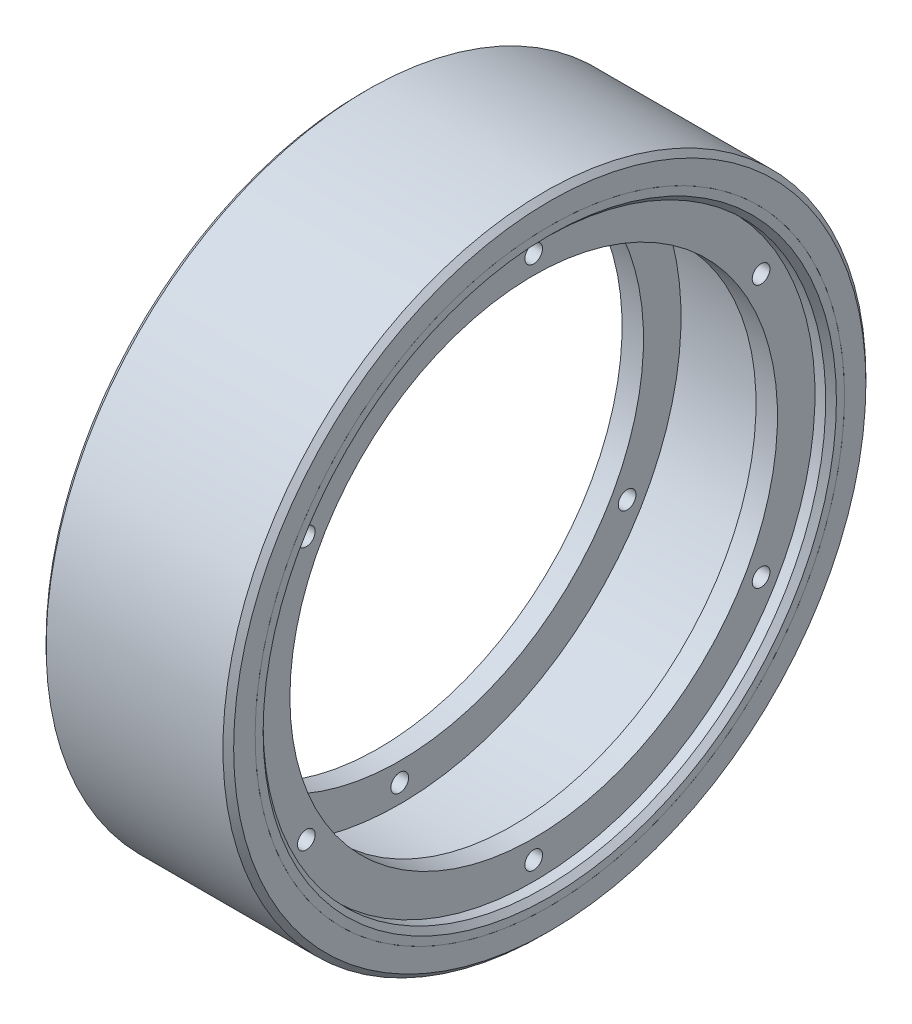
from build123d import *

# Parameters (mm, degrees)
SKETCH_1_R                  = 60
SKETCH_1_R_2                = 55
EXTRUDE_1_DEPTH             = 17.5
SKETCH_5_W                  = 1.65
SKETCH_5_H                  = 32
HOLE_WIZARD_M4_1_AT_2_COUNT = 2
HOLE_WIZARD_M4_1_AT_2_PITCH = 49
HOLE_WIZARD_M4_1_AT_3_COUNT = 2
HOLE_WIZARD_M4_1_AT_3_PITCH = 84.870489571
HOLE_WIZARD_M4_1_AT_4_COUNT = 2
HOLE_WIZARD_M4_1_AT_4_PITCH = 98
HOLE_WIZARD_M4_1_AT_5_COUNT = 2
HOLE_WIZARD_M4_1_AT_5_PITCH = 84.870489571
HOLE_WIZARD_M4_1_AT_6_COUNT = 2
HOLE_WIZARD_M4_1_AT_6_PITCH = 49
CHAMFER_1_SIZE              = 1
CHAMFER_2_SIZE              = 1


with BuildPart() as part:
    # 草图1 → 凸台-拉伸1 (new, symmetric)
    with BuildSketch(Plane(origin=(0, 0, 0), x_dir=(0, 0, -1), z_dir=(1, 0, 0))):
        Circle(SKETCH_1_R)
        Circle(SKETCH_1_R_2, mode=Mode.SUBTRACT)
    extrude(amount=EXTRUDE_1_DEPTH, both=True)

    # 倒角1
    chamfer_1_edges = [part.edges().sort_by_distance(p)[0] for p in [
        (-17.5, 0, 60),
        (17.5, 0, 60),
    ]]
    chamfer(chamfer_1_edges, length=CHAMFER_1_SIZE)


with BuildPart() as body_2:
    # 草图2 → 旋转1 (revolve)
    with BuildSketch(Plane.XY, mode=Mode.PRIVATE) as revolve_1_sk:
        Polygon((17.5, 55), (-17.5, 55), (-17.5, 52.5), (-14.5, 52.5), (-14.5, 45.5), (-10.5, 45.5), (-10.5, 52.5), (10.5, 52.5), (10.5, 45.5), (14.5, 45.5), (14.5, 52.5), (17.5, 52.5), align=None)
    revolve(revolve_1_sk.sketch.rotate(Axis((0, 0, 0), (1, 0, 0)), 90), axis=Axis((0, 0, 0), (1, 0, 0)))

    # 草图5 → M4 螺纹孔1 (revolve, cut)
    with BuildSketch(Plane(origin=(-14.5, 49, 0), x_dir=(0, 0, 1), z_dir=(0, 1, 0))):
        with Locations((0.825, 16)):
            Rectangle(SKETCH_5_W, SKETCH_5_H)
    hole_wizard_m4_1 = revolve(axis=Axis((-20.85, 49, 0), (1, 0, 0)), mode=Mode.SUBTRACT)

    # M4 螺纹孔1 at 2: M4 螺纹孔1 ×2
    with Locations(*[Vector(0, -0.49999999999999994, 0.8660254037844387) * (i * HOLE_WIZARD_M4_1_AT_2_PITCH) for i in range(1, HOLE_WIZARD_M4_1_AT_2_COUNT)]):
        add(hole_wizard_m4_1, mode=Mode.SUBTRACT)

    # M4 螺纹孔1 at 3: M4 螺纹孔1 ×2
    with Locations(*[Vector(0, -0.8660254037844386, 0.5000000000000001) * (i * HOLE_WIZARD_M4_1_AT_3_PITCH) for i in range(1, HOLE_WIZARD_M4_1_AT_3_COUNT)]):
        add(hole_wizard_m4_1, mode=Mode.SUBTRACT)

    # M4 螺纹孔1 at 4: M4 螺纹孔1 ×2
    with Locations(*[(0, -i * HOLE_WIZARD_M4_1_AT_4_PITCH, 0) for i in range(1, HOLE_WIZARD_M4_1_AT_4_COUNT)]):
        add(hole_wizard_m4_1, mode=Mode.SUBTRACT)

    # M4 螺纹孔1 at 5: M4 螺纹孔1 ×2
    with Locations(*[Vector(0, -0.8660254037844387, -0.49999999999999983) * (i * HOLE_WIZARD_M4_1_AT_5_PITCH) for i in range(1, HOLE_WIZARD_M4_1_AT_5_COUNT)]):
        add(hole_wizard_m4_1, mode=Mode.SUBTRACT)

    # M4 螺纹孔1 at 6: M4 螺纹孔1 ×2
    with Locations(*[Vector(0, -0.49999999999999994, -0.8660254037844387) * (i * HOLE_WIZARD_M4_1_AT_6_PITCH) for i in range(1, HOLE_WIZARD_M4_1_AT_6_COUNT)]):
        add(hole_wizard_m4_1, mode=Mode.SUBTRACT)

    # 倒角2
    chamfer_2_edges = [body_2.edges().sort_by_distance(p)[0] for p in [
        (-17.5, 0, -52.5),
        (17.5, 0, -52.5),
    ]]
    chamfer(chamfer_2_edges, length=CHAMFER_2_SIZE)


solid = Compound([part.part, body_2.part])
